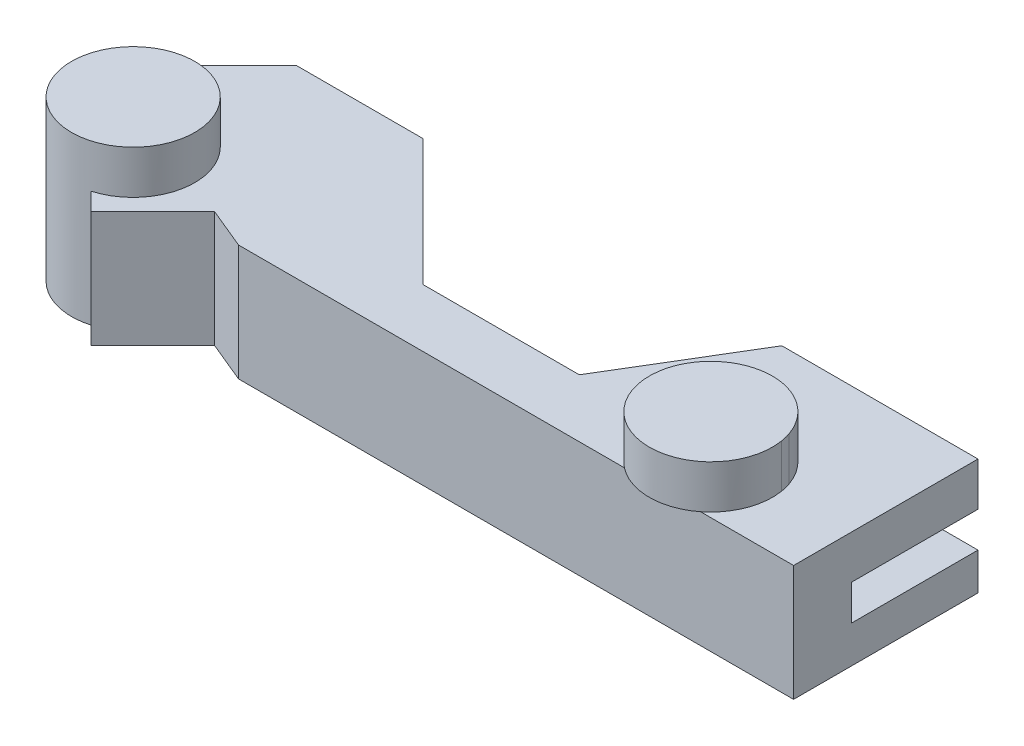
from build123d import *

# Parameters (mm, degrees)
BOSS_EXTRUDE1_DEPTH   = 6
SKETCH2_R             = 4.25
BOSS_EXTRUDE1_2_DEPTH = 6
BOSS_EXTRUDE2_DEPTH   = 3
BOSS_EXTRUDE3_START   = -5
BOSS_EXTRUDE3_DEPTH   = 5
BOSS_EXTRUDE4_DEPTH   = 2.56
SKETCH4_R             = 4.247751339
BOSS_EXTRUDE5_DEPTH   = 3


with BuildPart() as part:
    # Sketch2 → Boss-Extrude1 (new body)
    with BuildSketch(Plane(origin=(0, 0, 0), x_dir=(1, 0, 0), z_dir=(0, 1, 0))):
        with BuildLine():
            ThreePointArc((33.43268592, 0), (29.235330072, 3.583138785), (25.037974223, 0))
            Line((25.037974223, 0), (33.43268592, 0))
        make_face()
    extrude(amount=BOSS_EXTRUDE1_DEPTH)



with BuildPart() as body_2:
    # Sketch2 → Boss-Extrude1 2 (new body)
    with BuildSketch(Plane(origin=(0, 0, 0), x_dir=(1, 0, 0), z_dir=(0, 1, 0))):
        with Locations((-9.482754905, -1.788781285)):
            Circle(SKETCH2_R)
    extrude(amount=BOSS_EXTRUDE1_2_DEPTH)


with BuildPart() as part_1:
    add(part.part)

    add(body_2.part)  # Boss-Extrude2 merges body 2
    # Sketch2<7> → Boss-Extrude2 (add)
    with BuildSketch(Plane(origin=(0, 0, 0), x_dir=(1, 0, 0), z_dir=(0, 1, 0))):
        with BuildLine():
            Line((0, 8.718626612), (-8.718626612, 8.718626612))
            Line((-8.718626612, 8.718626612), (-11.561455819, 5.875797405))
            Line((-11.561455819, 5.875797405), (-15.748205688, 1.58521084))
            Line((-15.748205688, 1.58521084), (-13.563084148, -0.5999107))
            ThreePointArc((-13.563084148, -0.5999107), (-6.477551085, 1.216422535), (-8.29388432, -5.869110529))
            Line((-8.29388432, -5.869110529), (-7.081497424, -7.081497424))
            Line((-7.081497424, -7.081497424), (-2.828427125, -2.828427125))
            Line((-2.828427125, -2.828427125), (0, -4))
            Line((0, -4), (38.28, -4))
            Line((38.28, -4), (38.28, 8.718626612))
            Line((38.28, 8.718626612), (24.755242586, 8.718626612))
            Line((24.755242586, 8.718626612), (19.499755178, 0))
            Line((19.499755178, 0), (8.718626612, 0))
            Line((8.718626612, 0), (0, 8.718626612))
        make_face()
        with BuildLine():
            Line((33.43268592, 0), (25.037974223, 0))
            ThreePointArc((25.037974223, 0), (29.235330072, 3.583138785), (33.43268592, 0))
        make_face(mode=Mode.SUBTRACT)
    extrude(amount=BOSS_EXTRUDE2_DEPTH)

    # Sketch2<9> → Boss-Extrude3 (add)
    with BuildSketch(Plane(origin=(0, 0, 0), x_dir=(1, 0, 0), z_dir=(0, 1, 0)).offset(BOSS_EXTRUDE3_START)):
        with BuildLine():
            Line((0, 0), (-8.718626612, 8.718626612))
            Line((-8.718626612, 8.718626612), (-11.561455819, 5.875797405))
            Line((-11.561455819, 5.875797405), (-15.748205688, 1.58521084))
            Line((-15.748205688, 1.58521084), (-13.563084148, -0.5999107))
            ThreePointArc((-13.563084148, -0.5999107), (-12.487958725, -4.793985106), (-8.29388432, -5.869110529))
            Line((-8.29388432, -5.869110529), (-7.081497424, -7.081497424))
            Line((-7.081497424, -7.081497424), (-2.828427125, -2.828427125))
            Line((-2.828427125, -2.828427125), (0, -4))
            Line((0, -4), (38.28, -4))
            Line((38.28, -4), (38.28, 0))
            Line((38.28, 0), (0, 0))
        make_face()
    extrude(amount=BOSS_EXTRUDE3_DEPTH)

    # Sketch3 → Boss-Extrude4 (add)
    with BuildSketch(Plane(origin=(0, -5, 0), x_dir=(-1, 0, 0), z_dir=(0, -1, 0))):
        Polygon((-38.28, -4), (-38.28, 8.718626612), (-24.755242586, 8.718626612), (-19.499755178, 0), (-8.718626612, 0), (0, 8.718626612), (8.718626612, 8.718626612), (15.748205688, 1.58521084), (13.563084148, -0.5999107), (7.081497424, -7.081497424), (2.828427125, -2.828427125), (0, -4), align=None)
    extrude(amount=-BOSS_EXTRUDE4_DEPTH)

    # Sketch4 → Boss-Extrude5 (add)
    with BuildSketch(Plane(origin=(0, 3, 0), x_dir=(1, 0, 0), z_dir=(0, 1, 0))):
        with Locations((29.235330072, -0.66)):
            Circle(SKETCH4_R)
    extrude(amount=BOSS_EXTRUDE5_DEPTH)


solid = part_1.part
